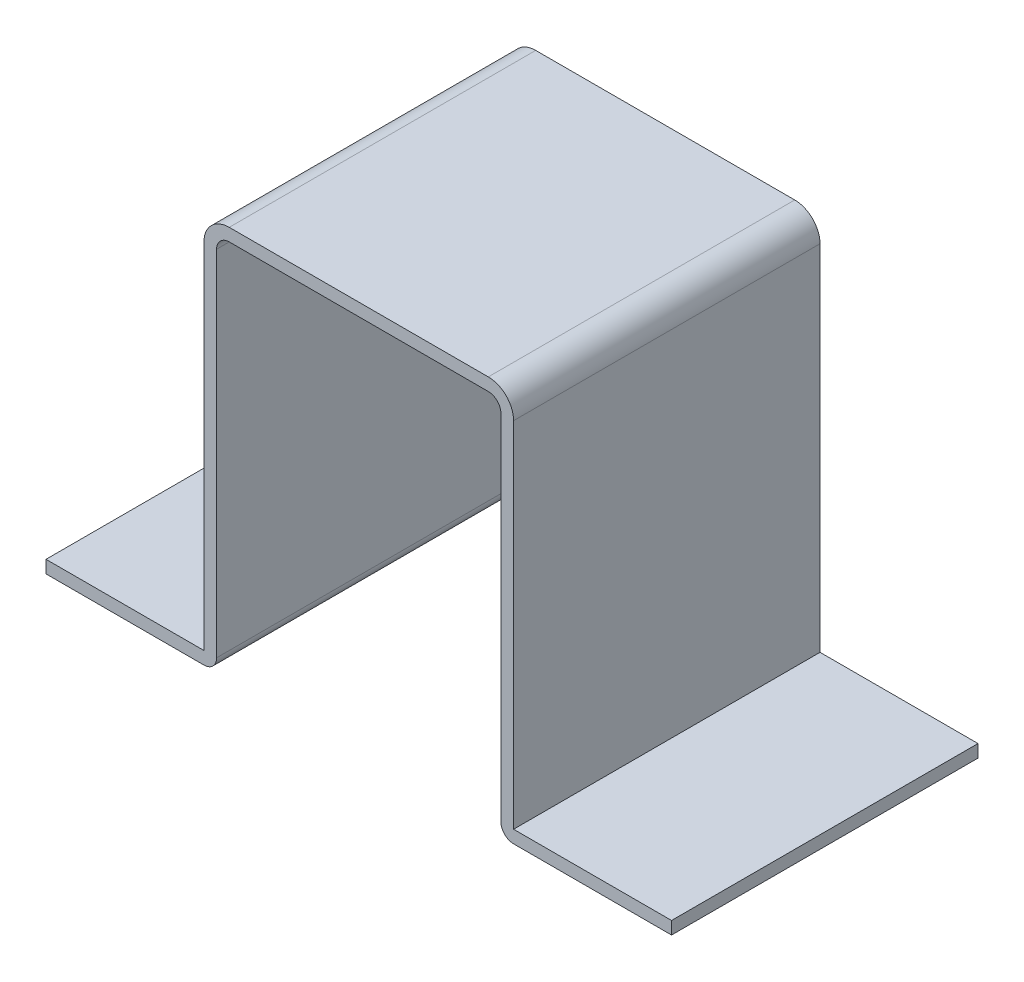
from build123d import *

# Parameters (mm, degrees)
SALIENTE_EXTRUIR1_DEPTH = 24.25


with BuildPart() as part:
    # Croquis1 → Saliente-Extruir1 (new, symmetric)
    with BuildSketch(Plane.XY):
        with BuildLine():
            Line((24.5, -30), (49.5, -30))
            Line((49.5, -30), (49.5, -28))
            Line((49.5, -28), (24.5, -28))
            Line((24.5, -28), (24.5, 28))
            ThreePointArc((24.5, 28), (23.328427125, 30.828427125), (20.5, 32))
            Line((20.5, 32), (-20.5, 32))
            ThreePointArc((-20.5, 32), (-23.328427125, 30.828427125), (-24.5, 28))
            Line((-24.5, 28), (-24.5, -28))
            Line((-24.5, -28), (-49.5, -28))
            Line((-49.5, -28), (-49.5, -30))
            Line((-49.5, -30), (-24.5, -30))
            ThreePointArc((-24.5, -30), (-23.085786438, -29.414213562), (-22.5, -28))
            Line((-22.5, -28), (-22.5, 28))
            ThreePointArc((-22.5, 28), (-21.914213562, 29.414213562), (-20.5, 30))
            Line((-20.5, 30), (20.5, 30))
            ThreePointArc((20.5, 30), (21.914213562, 29.414213562), (22.5, 28))
            Line((22.5, 28), (22.5, -28))
            ThreePointArc((22.5, -28), (23.085786438, -29.414213562), (24.5, -30))
        make_face()
    extrude(amount=SALIENTE_EXTRUIR1_DEPTH, both=True)


solid = part.part
